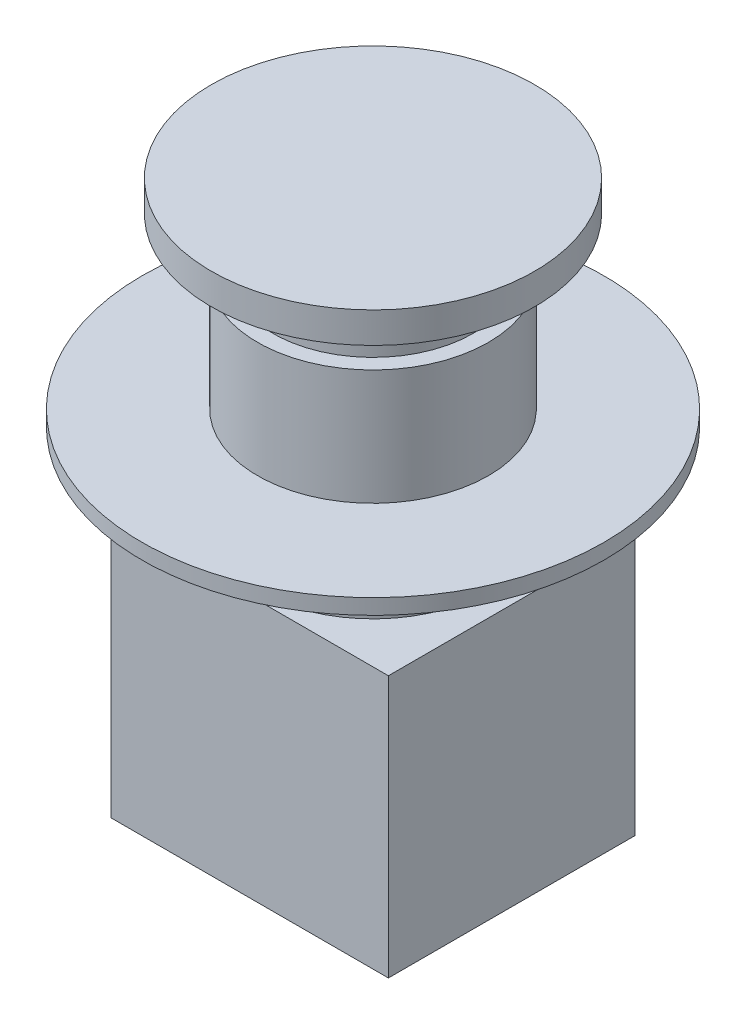
from build123d import *

# Parameters (mm, degrees)
ESQUISSE2_R        = 15
BOSS_EXTRU_1_DEPTH = 11
ESQUISSE3_W        = 36
ESQUISSE3_H        = 32
BOSS_EXTRU_2_DEPTH = 34


with BuildPart() as part:
    # Esquisse1 → Révolution1 (revolve)
    with BuildSketch(Plane.XY, mode=Mode.PRIVATE) as r_volution1_sk:
        Polygon((0, 0), (30, 0), (30, 2), (15, 2), (15, 17), (13, 17), (13, 24), (21, 24), (21, 28), (0, 28), align=None)
    revolve(r_volution1_sk.sketch.rotate(Axis((0, 28, 0), (0, -1, 0)), 180), axis=Axis((0, 28, 0), (0, -1, 0)))

    # Esquisse2 → Boss.-Extru.1 (add)
    with BuildSketch(Plane(origin=(0, 0, 0), x_dir=(-1, 0, 0), z_dir=(0, -1, 0))):
        Circle(ESQUISSE2_R)
    extrude(amount=BOSS_EXTRU_1_DEPTH)

    # Esquisse3 → Boss.-Extru.2 (add)
    with BuildSketch(Plane(origin=(0, -11, 0), x_dir=(-1, 0, 0), z_dir=(0, -1, 0))):
        Rectangle(ESQUISSE3_W, ESQUISSE3_H)
    extrude(amount=BOSS_EXTRU_2_DEPTH)


solid = part.part
